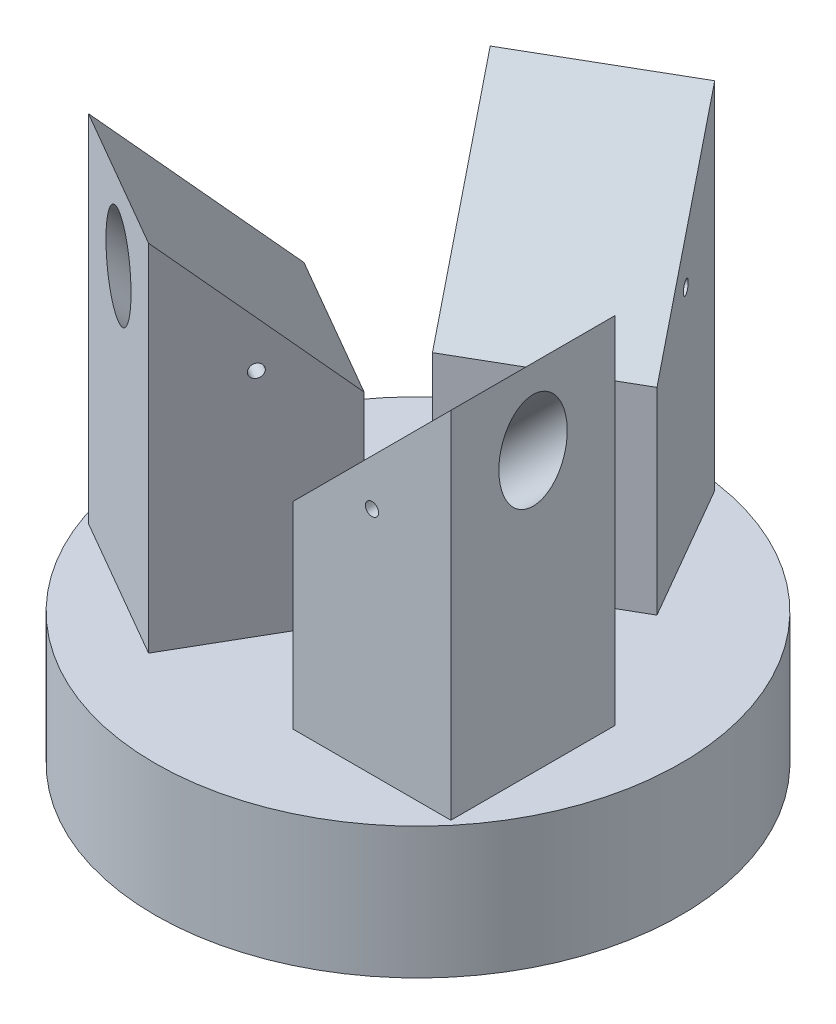
from build123d import *

# Parameters (mm, degrees)
SKETCH1_R           = 50.8
BOSS_EXTRUDE1_DEPTH = 25.4
SKETCH2_R           = 1.27
CUT_EXTRUDE1_DEPTH  = 12.7
BOSS_EXTRUDE2_DEPTH = 31.75
SKETCH9_R           = 6.604
CUT_EXTRUDE2_DEPTH  = 68.58
SKETCH10_R          = 1.27
CUT_EXTRUDE3_DEPTH  = 68.58
CIRPATTERN3_COUNT   = 3


with BuildPart() as part:
    # Sketch1 → Boss-Extrude1 (new body)
    with BuildSketch(Plane(origin=(0, 0, 0), x_dir=(1, 0, 0), z_dir=(0, 1, 0))):
        Circle(SKETCH1_R)
    extrude(amount=BOSS_EXTRUDE1_DEPTH)

    # Sketch2 → Cut-Extrude1 (cut)
    with BuildSketch(Plane.XZ):
        with Locations((-25.4, 0)):
            Circle(SKETCH2_R)
        with Locations((0, 25.4)):
            Circle(SKETCH2_R)
        with Locations((25.4, 0)):
            Circle(SKETCH2_R)
        with Locations((0, -25.4)):
            Circle(SKETCH2_R)
    extrude(amount=-CUT_EXTRUDE1_DEPTH, mode=Mode.SUBTRACT)

    # Sketch4 → Boss-Extrude2 (add)
    with BuildSketch(Plane.XY):
        Polygon((7.62, 25.4), (7.62, 63.5), (38.1, 93.98), (38.1, 25.4), align=None)
    boss_extrude2 = extrude(amount=BOSS_EXTRUDE2_DEPTH)

    # Sketch9 → Cut-Extrude2 (cut)
    with BuildSketch(Plane(origin=(66.802, 66.802, 0), x_dir=(0, 0, -1), z_dir=(0.7071067811865512, 0.7071067811865439, 0))):
        with Locations((-15.875, 29.160757667)):
            Circle(SKETCH9_R)
    cut_extrude2 = extrude(amount=-CUT_EXTRUDE2_DEPTH, mode=Mode.SUBTRACT)

    # Sketch10 → Cut-Extrude3 (cut)
    with BuildSketch(Plane.XY.offset(31.75)):
        with Locations((22.86, 69.85)):
            Circle(SKETCH10_R)
    cut_extrude3 = extrude(amount=-CUT_EXTRUDE3_DEPTH, mode=Mode.SUBTRACT)

    # CirPattern3: Boss-Extrude2, Cut-Extrude2, Cut-Extrude3 ×3 about axis
    cirpattern3_axis = Axis((0, 25.4, 0), (0, -1, 0))
    add([boss_extrude2.rotate(cirpattern3_axis, i * 360 / CIRPATTERN3_COUNT) for i in range(1, CIRPATTERN3_COUNT)])
    add([cut_extrude2.rotate(cirpattern3_axis, i * 360 / CIRPATTERN3_COUNT) for i in range(1, CIRPATTERN3_COUNT)], mode=Mode.SUBTRACT)
    add([cut_extrude3.rotate(cirpattern3_axis, i * 360 / CIRPATTERN3_COUNT) for i in range(1, CIRPATTERN3_COUNT)], mode=Mode.SUBTRACT)


solid = part.part
